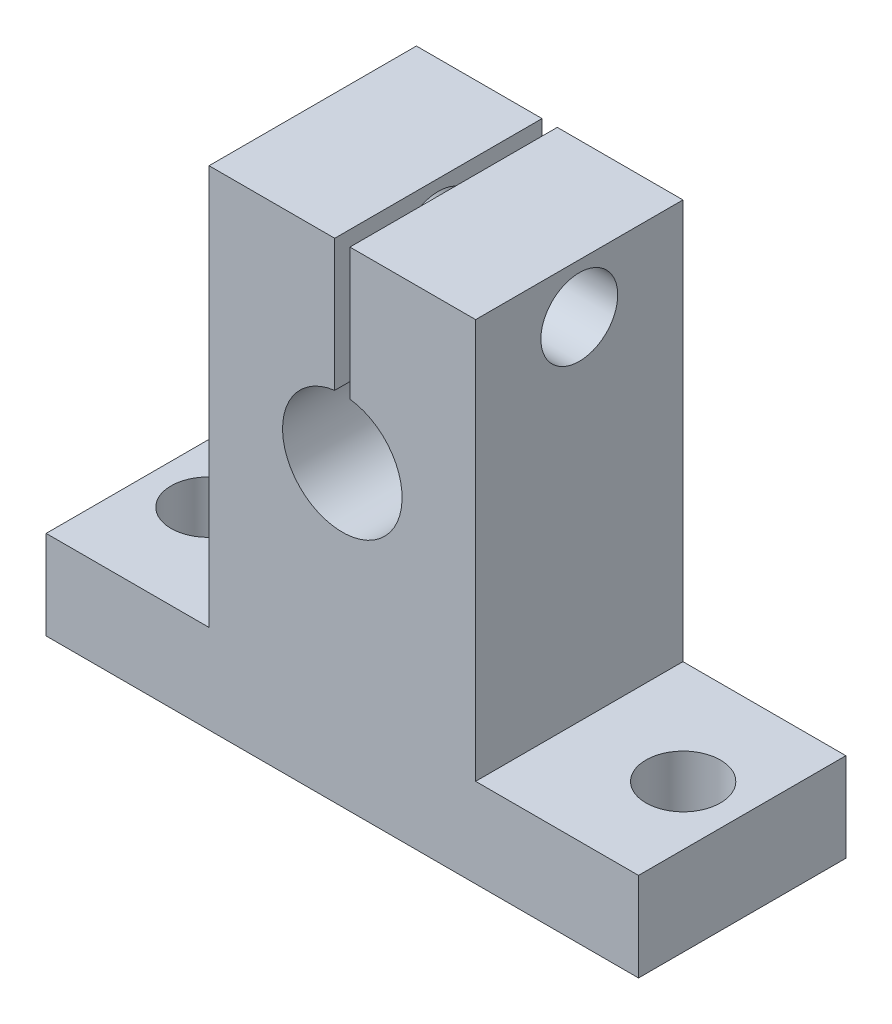
from build123d import *

# Parameters (mm, degrees)
SALIENTE_EXTRUIR1_DEPTH = 14
CROQUIS2_R              = 4.035649311
CORTAR_EXTRUIR1_DEPTH   = 14
CROQUIS5_R              = 2.497749653
CORTAR_EXTRUIR2_DEPTH   = 14
CROQUIS7_R              = 2.514867633
CORTAR_EXTRUIR3_DEPTH   = 14
CROQUIS8_W              = 1.02892534
CROQUIS8_H              = 10.439450899
CORTAR_EXTRUIR4_DEPTH   = 14
CROQUIS9_R              = 2.593975345
CORTAR_EXTRUIR5_DEPTH   = 37.745892113


with BuildPart() as part:
    # Croquis1 → Saliente-Extruir1 (new body)
    with BuildSketch(Plane.XY):
        Polygon((-2.000386176, 17.69916911), (15.999613824, 17.69916911), (15.999613824, -9.30083089), (26.999613824, -9.30083089), (26.999613824, -15.30083089), (15.999613824, -15.30083089), (-2.000386176, -15.30083089), (-13.000386176, -15.30083089), (-13.000386176, -9.30083089), (-2.000386176, -9.30083089), align=None)
    extrude(amount=SALIENTE_EXTRUIR1_DEPTH)

    # Croquis2 → Cortar-Extruir1 (cut)
    with BuildSketch(Plane.XY.offset(14)):
        with Locations((6.999613824, 4.803097651)):
            Circle(CROQUIS2_R)
    extrude(amount=-CORTAR_EXTRUIR1_DEPTH, mode=Mode.SUBTRACT)

    # Croquis5 → Cortar-Extruir2 (cut)
    with BuildSketch(Plane(origin=(0, -9.30083089, 0), x_dir=(1, 0, 0), z_dir=(0, 1, 0))):
        with Locations(Location((-9.06576441, -7, 0), (0, 0, 270))):
            Circle(CROQUIS5_R)
    extrude(amount=-CORTAR_EXTRUIR2_DEPTH, mode=Mode.SUBTRACT)

    # Croquis7 → Cortar-Extruir3 (cut)
    with BuildSketch(Plane(origin=(0, -9.30083089, 0), x_dir=(1, 0, 0), z_dir=(0, 1, 0))):
        with Locations(Location((23.014515722, -7, 0), (0, 0, 270))):
            Circle(CROQUIS7_R)
    extrude(amount=-CORTAR_EXTRUIR3_DEPTH, mode=Mode.SUBTRACT)

    # Croquis8 → Cortar-Extruir4 (cut)
    with BuildSketch(Plane.XY.offset(14)):
        with Locations((6.999613824, 13.435682)):
            Rectangle(CROQUIS8_W, CROQUIS8_H)
    extrude(amount=-CORTAR_EXTRUIR4_DEPTH, mode=Mode.SUBTRACT)

    # Croquis9 → Cortar-Extruir5 (cut, through all)
    with BuildSketch(Plane.ZY.offset(2.000386176)):
        with Locations(Location((7, 14.351263228, 0), (0, 0, 270))):
            Circle(CROQUIS9_R)
    extrude(amount=-CORTAR_EXTRUIR5_DEPTH, mode=Mode.SUBTRACT)


solid = part.part
